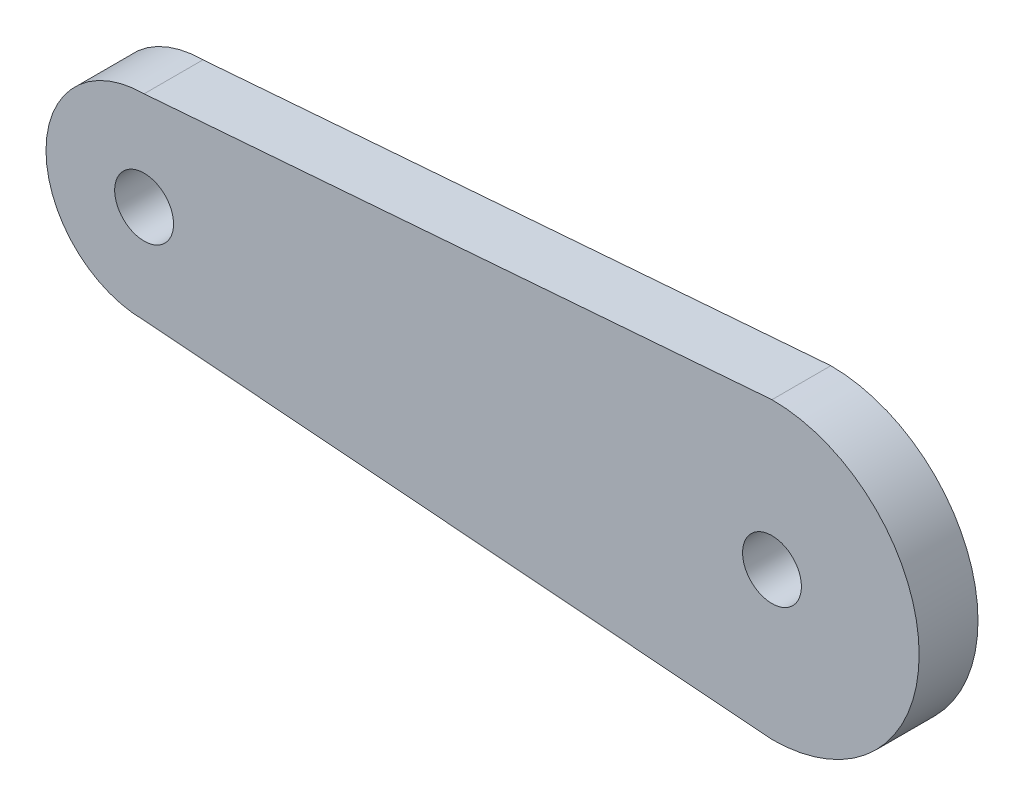
from build123d import *

# Parameters (mm, degrees)
SKETCH1_R           = 1.5
BOSS_EXTRUDE1_DEPTH = 3


with BuildPart() as part:
    # Sketch1 → Boss-Extrude1 (new body)
    with BuildSketch(Plane.XY):
        with BuildLine():
            ThreePointArc((32, 7.5), (39.5, 0), (32, -7.5))
            Line((32, -7.5), (0, -5))
            ThreePointArc((0, -5), (-5, 0), (0, 5))
            Line((0, 5), (32, 7.5))
        make_face()
        with Locations((32, 0)):
            Circle(SKETCH1_R, mode=Mode.SUBTRACT)
        Circle(SKETCH1_R, mode=Mode.SUBTRACT)
    extrude(amount=BOSS_EXTRUDE1_DEPTH)


solid = part.part
